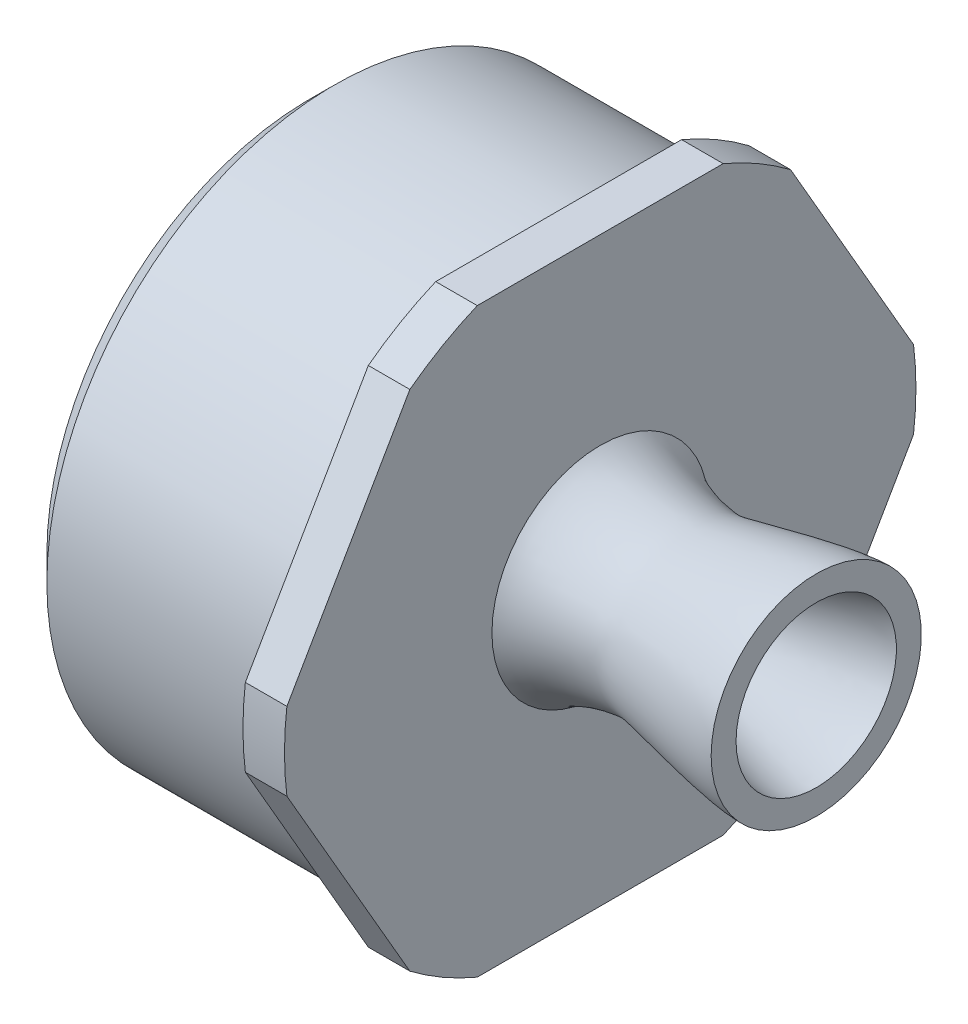
from build123d import *

# Parameters (mm, degrees)
CORTE_EXTRUS_O1_REACH = 66.133
PADR_OCIRCULAR1_COUNT = 6


with BuildPart() as part:
    # Esboço5 → Revolução2 (revolve)
    with BuildSketch(Plane(origin=(0, 0, 0), x_dir=(1, 0, 0), z_dir=(0, 1, 0)), mode=Mode.PRIVATE) as revolu_o2_sk:
        with BuildLine():
            Line((30, 34.6), (30, 38))
            Line((30, 38), (35, 38))
            Line((35, 38), (35, 13.034480978))
            add(Edge.make_bspline(
                [(35, 13.034480978), (38.108675957, 10.648534591), (43.835508458, 9.861753235), (46.598549995, 10.040745389), (57.264939348, 12.650201836), (61, 12.65)],
                knots=[0, 0, 0, 0, 0.39411742, 0.49411742, 1, 1, 1, 1], degree=3))
            Line((61, 12.65), (61, 9.65))
            add(Edge.make_bspline(
                [(0, 28.6), (20.31391897, 8.95615601), (43.784583373, 4.835357072), (46.678252365, 5.00429716), (57.291609233, 9.661966126), (61, 9.65)],
                knots=[0, 0, 0, 0, 0.416422234, 0.516422234, 1, 1, 1, 1], degree=3))
            Line((0, 28.6), (0, 31.6))
            Line((0, 31.6), (3, 34.6))
            Line((3, 34.6), (30, 34.6))
        make_face()
    revolve(revolu_o2_sk.sketch.rotate(Axis((0, 0, 0), (1, 0, 0)), 180), axis=Axis((0, 0, 0), (1, 0, 0)))

    # Esboço30 → Corte-extrusão1 (cut, up to next)
    with BuildSketch(Plane(origin=(35, 0, 0), x_dir=(0, 0, -1), z_dir=(1, 0, 0)), mode=Mode.PRIVATE) as corte_extrus_o1_sk1:
        with BuildLine():
            Line((-14.798648587, 35), (14.798648587, 35))
            ThreePointArc((14.798648587, 35), (0, 38), (-14.798648587, 35))
        make_face()
    corte_extrus_o1_tool1 = extrude(corte_extrus_o1_sk1.sketch, amount=-CORTE_EXTRUS_O1_REACH, mode=Mode.PRIVATE) & part.part
    corte_extrus_o1 = corte_extrus_o1_tool1.solids().sort_by_distance((35, 36.204155, 0))[0]
    add(corte_extrus_o1, mode=Mode.SUBTRACT)

    # PadrãoCircular1: Corte-extrusão1 ×6 about axis
    padr_ocircular1_axis = Axis((0, 0, 0), (1, 0, 0))
    for i in range(1, PADR_OCIRCULAR1_COUNT):
        add(corte_extrus_o1.rotate(padr_ocircular1_axis, i * 360 / PADR_OCIRCULAR1_COUNT), mode=Mode.SUBTRACT)


solid = part.part
